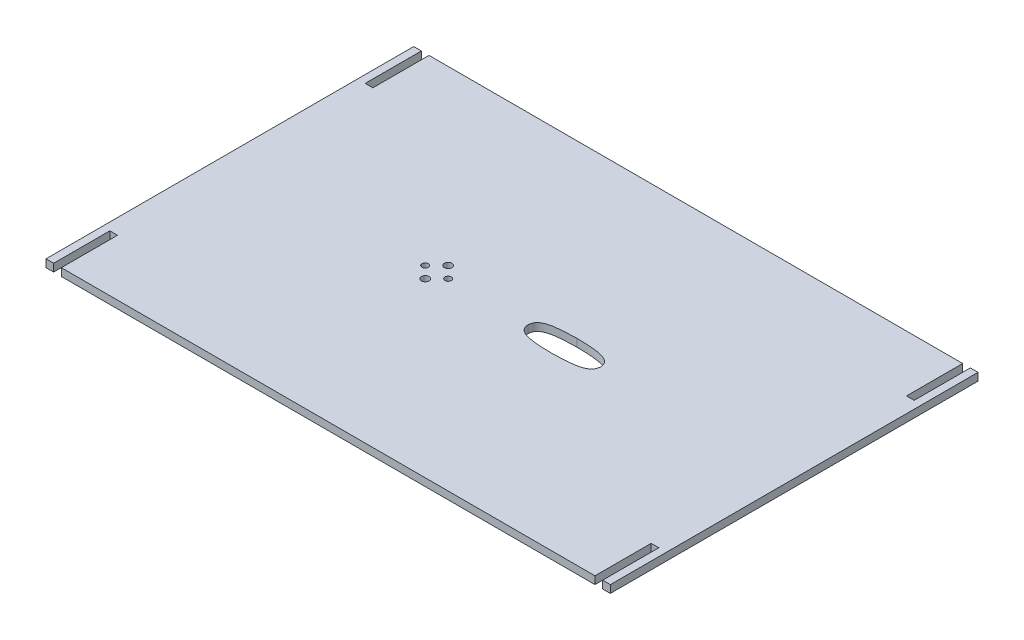
from build123d import *

# Parameters (mm, degrees)
BOSS_EXTRUDE1_DEPTH = 6
SKETCH2_R           = 3
SKETCH2_R_2         = 2.5
CUT_EXTRUDE1_DEPTH  = 6


with BuildPart() as part:
    # Sketch1 → Boss-Extrude1 (new body)
    with BuildSketch(Plane(origin=(0, 0, 0), x_dir=(1, 0, 0), z_dir=(0, 1, 0))):
        Polygon((418, 244), (424, 244), (424, 288), (430, 288), (430, 0), (424, 0), (424, 44), (418, 44), (418, 0), (0, 0), (0, 44), (-6, 44), (-6, 0), (-12, 0), (-12, 288), (-6, 288), (-6, 244), (0, 244), (0, 288), (418, 288), align=None)
    extrude(amount=BOSS_EXTRUDE1_DEPTH)

    # Sketch2 → Cut-Extrude1 (cut)
    with BuildSketch(Plane(origin=(0, 6, 0), x_dir=(1, 0, 0), z_dir=(0, 1, 0))):
        with Locations(Location((150, 135, 0), (0, 0, 270))):
            Circle(SKETCH2_R)
        with Locations(Location((150, 153, 0), (0, 0, 270))):
            Circle(SKETCH2_R)
        with Locations(Location((141, 144, 0), (0, 0, 270))):
            Circle(SKETCH2_R_2)
        with Locations(Location((159, 144, 0), (0, 0, 270))):
            Circle(SKETCH2_R_2)
        with BuildLine():
            add(Edge.make_bspline(
                [(250, 154), (231.978482396, 153.666282679), (221.933324248, 152.446887217), (221.5, 144)],
                knots=[0, 0, 0, 0, 1, 1, 1, 1], degree=3))
            add(Edge.make_bspline(
                [(250, 134), (231.978482396, 134.333717321), (221.933324248, 135.553112783), (221.5, 144)],
                knots=[0, 0, 0, 0, 1, 1, 1, 1], degree=3))
            add(Edge.make_bspline(
                [(250, 134), (268.021517604, 134.333717321), (278.066675752, 135.553112783), (278.5, 144)],
                knots=[0, 0, 0, 0, 1, 1, 1, 1], degree=3))
            add(Edge.make_bspline(
                [(250, 154), (268.021517604, 153.666282679), (278.066675752, 152.446887217), (278.5, 144)],
                knots=[0, 0, 0, 0, 1, 1, 1, 1], degree=3))
        make_face()
    extrude(amount=-CUT_EXTRUDE1_DEPTH, mode=Mode.SUBTRACT)


solid = part.part
